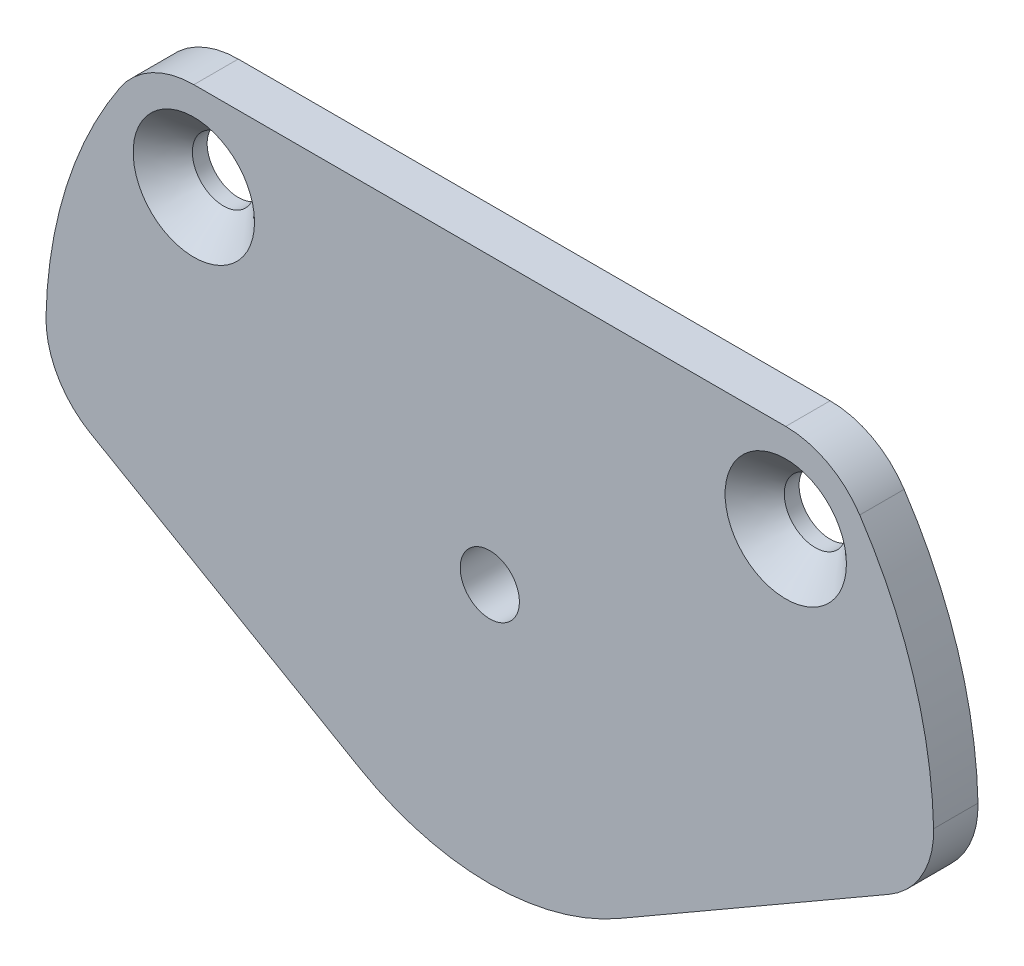
from build123d import *

# Parameters (mm, degrees)
SKETCH_1_R      = 2.1
SKETCH_1_R_2    = 2
EXTRUDE_1_DEPTH = 1.5
CHAMFER_1_SIZE  = 2


with BuildPart() as part:
    # 草图1 → 凸台-拉伸1 (new, symmetric)
    with BuildSketch(Plane.XY):
        with BuildLine():
            Line((-20, 19.266499161), (20, 19.266499161))
            ThreePointArc((20, 19.266499161), (22.837274331, 18.553263235), (25, 16.583123952))
            ThreePointArc((25, 16.583123952), (28.617303042, 9.002775495), (29.991436749, 0.716743841))
            ThreePointArc((29.991436749, 0.716743841), (29.224770759, -2.364314571), (26.993149399, -4.62275735))
            Line((26.993149399, -4.62275735), (8.75, -15.155444566))
            ThreePointArc((8.75, -15.155444566), (0, -17.5), (-8.75, -15.155444566))
            Line((-8.75, -15.155444566), (-26.993149399, -4.62275735))
            ThreePointArc((-26.993149399, -4.62275735), (-29.224770759, -2.364314571), (-29.991436749, 0.716743841))
            ThreePointArc((-29.991436749, 0.716743841), (-28.617303042, 9.002775495), (-25, 16.583123952))
            ThreePointArc((-25, 16.583123952), (-22.837274331, 18.553263235), (-20, 19.266499161))
        make_face()
        with Locations((-20, 13.266499161)):
            Circle(SKETCH_1_R, mode=Mode.SUBTRACT)
        with Locations((20, 13.266499161)):
            Circle(SKETCH_1_R, mode=Mode.SUBTRACT)
        Circle(SKETCH_1_R_2, mode=Mode.SUBTRACT)
    extrude(amount=EXTRUDE_1_DEPTH, both=True)

    # 倒角1
    chamfer_1_edges = [part.edges().sort_by_distance(p)[0] for p in [
        (-22.1, 13.266499161, 1.5),
        (17.9, 13.266499161, 1.5),
    ]]
    chamfer(chamfer_1_edges, length=CHAMFER_1_SIZE)


solid = part.part
